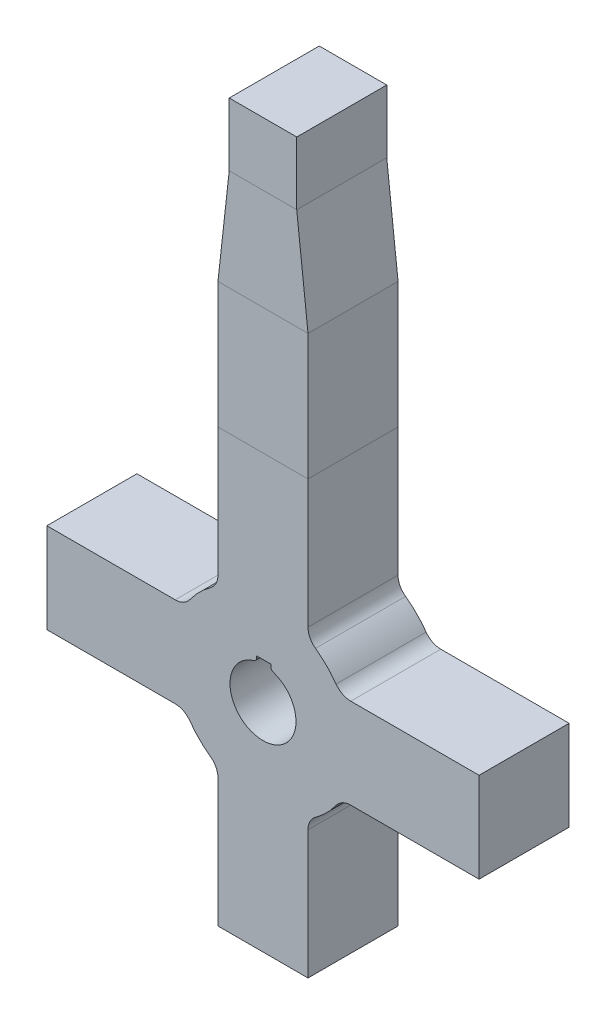
from build123d import *

# Parameters (mm, degrees)
SKETCH2_R                = 50
BOSS_EXTRUDE1_DEPTH      = 50
BOSS_EXTRUDE2_DEPTH      = 50
FILLET1_R                = 10
CIRPATTERN1_COUNT        = 4
FILLET1_OF_CIRPATTERN1_R = 10
CUT_EXTRUDE1_DEPTH       = 177.91806013
SKETCH11_W               = 50
SKETCH11_H               = 70
BOSS_EXTRUDE7_DEPTH      = 50
BOSS_EXTRUDE8_DEPTH      = 50
SKETCH14_W               = 37.5
SKETCH14_H               = 35
BOSS_EXTRUDE9_DEPTH      = 50


with BuildPart() as part:
    # Sketch2 → Boss-Extrude1 (new body)
    with BuildSketch(Plane.XY):
        Circle(SKETCH2_R)
    extrude(amount=BOSS_EXTRUDE1_DEPTH)

    # Sketch2<3> → Boss-Extrude2 (add)
    with BuildSketch(Plane.XY):
        with BuildLine():
            ThreePointArc((-43.301270189, -25), (-48.296291314, -12.940952255), (-50, 0))
            ThreePointArc((-50, 0), (-48.296291314, 12.940952255), (-43.301270189, 25))
            Line((-43.301270189, 25), (-120, 25))
            Line((-120, 25), (-120, -25))
            Line((-120, -25), (-43.301270189, -25))
        make_face()
    boss_extrude2 = extrude(amount=BOSS_EXTRUDE2_DEPTH)

    # Fillet1
    fillet1_edges = [part.edges().sort_by_distance(p)[0] for p in [
        (-43.301270189, 25, 25),
        (-43.301270189, -25, 25),
    ]]
    fillet(fillet1_edges, radius=FILLET1_R)

    # CirPattern1: Boss-Extrude2 ×4 about axis
    cirpattern1_axis = Axis((0, 0, 0), (0, 0, 1))
    for i in range(1, CIRPATTERN1_COUNT):
        add(boss_extrude2.rotate(cirpattern1_axis, i * 360 / CIRPATTERN1_COUNT))

    # Fillet1 of CirPattern1
    fillet1_of_cirpattern1_edges = [part.edges().sort_by_distance(p)[0] for p in [
        (-25, -43.301270189, 25),
        (25, -43.301270189, 25),
        (43.301270189, -25, 25),
        (43.301270189, 25, 25),
        (25, 43.301270189, 25),
        (-25, 43.301270189, 25),
    ]]
    fillet(fillet1_of_cirpattern1_edges, radius=FILLET1_OF_CIRPATTERN1_R)

    # Sketch3 → Cut-Extrude1 (cut, through all)
    with BuildSketch(Plane.XY.offset(50)):
        with BuildLine():
            Line((-3.629295483, 19.531446755), (-3.629295483, 20.653397312))
            Line((-3.629295483, 20.653397312), (4.42625265, 20.653397312))
            Line((4.42625265, 20.653397312), (4.42625265, 19.283922238))
            ThreePointArc((4.42625265, 19.283922238), (4.803815258, 18.114436492), (5.79394956, 17.386504834))
            ThreePointArc((5.79394956, 17.386504834), (-0.376200303, -18.322632867), (-5.075407996, 17.609674487))
            ThreePointArc((-5.075407996, 17.609674487), (-4.031206785, 18.328902572), (-3.629295483, 19.531446755))
        make_face()
    extrude(amount=-CUT_EXTRUDE1_DEPTH, mode=Mode.SUBTRACT)


with BuildPart() as body_2:
    # Sketch11 → Boss-Extrude7 (new body)
    with BuildSketch(Plane.ZY.offset(25)):
        with Locations((25, 155)):
            Rectangle(SKETCH11_W, SKETCH11_H)
    extrude(amount=-BOSS_EXTRUDE7_DEPTH)


with BuildPart() as body_3:
    # Sketch13 → Boss-Extrude8 (new body)
    with BuildSketch(Plane(origin=(0, 0, 0), x_dir=(-1, 0, 0), z_dir=(0, 0, -1))):
        Polygon((-25, 190), (25, 190), (18.75, 246.334032592), (-18.75, 246.334032592), align=None)
    extrude(amount=-BOSS_EXTRUDE8_DEPTH)


with BuildPart() as body_4:
    # Sketch14 → Boss-Extrude9 (new body)
    with BuildSketch(Plane(origin=(0, 0, 0), x_dir=(-1, 0, 0), z_dir=(0, 0, -1))):
        with Locations((0, 263.834032592)):
            Rectangle(SKETCH14_W, SKETCH14_H)
    extrude(amount=-BOSS_EXTRUDE9_DEPTH)


solid = Compound([part.part, body_2.part, body_3.part, body_4.part])
